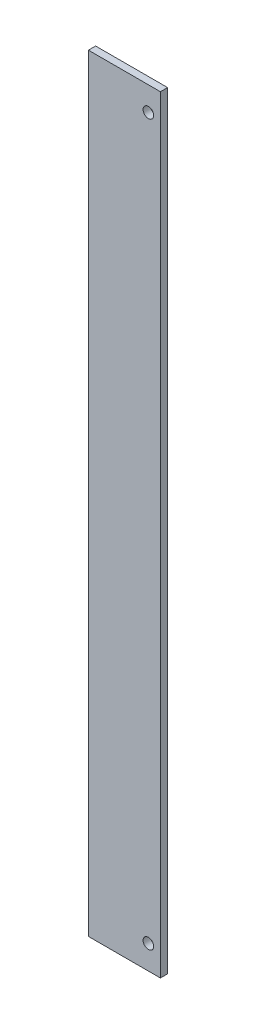
from build123d import *

# Parameters (mm, degrees)
ESQUISSE1_W             = 30
ESQUISSE1_H             = 320
BOSS_EXTRU_1_DEPTH      = 3
ENL_V_MAT_EXTRU_1_REACH = 192.418
ESQUISSE2_R             = 2.2


with BuildPart() as part:
    # Esquisse1 → Boss.-Extru.1 (new body)
    with BuildSketch(Plane.XY):
        with Locations((80, 5)):
            Rectangle(ESQUISSE1_W, ESQUISSE1_H)
    extrude(amount=BOSS_EXTRU_1_DEPTH)

    # Esquisse2 → Enlèv. mat.-Extru.1 (cut, up to next)
    with BuildSketch(Plane.XY.offset(3), mode=Mode.PRIVATE) as enl_v_mat_extru_1_sk1:
        with Locations((90, -145)):
            Circle(ESQUISSE2_R)
    enl_v_mat_extru_1_tool1 = extrude(enl_v_mat_extru_1_sk1.sketch, amount=-ENL_V_MAT_EXTRU_1_REACH, mode=Mode.PRIVATE) & part.part
    # Esquisse2 → Enlèv. mat.-Extru.1 (cut, up to next)
    with BuildSketch(Plane.XY.offset(3), mode=Mode.PRIVATE) as enl_v_mat_extru_1_sk2:
        with Locations((90, 155)):
            Circle(ESQUISSE2_R)
    enl_v_mat_extru_1_tool2 = extrude(enl_v_mat_extru_1_sk2.sketch, amount=-ENL_V_MAT_EXTRU_1_REACH, mode=Mode.PRIVATE) & part.part
    add(enl_v_mat_extru_1_tool1.solids().sort_by_distance((90, -145, 3))[0], mode=Mode.SUBTRACT)
    add(enl_v_mat_extru_1_tool2.solids().sort_by_distance((90, 155, 3))[0], mode=Mode.SUBTRACT)


solid = part.part
